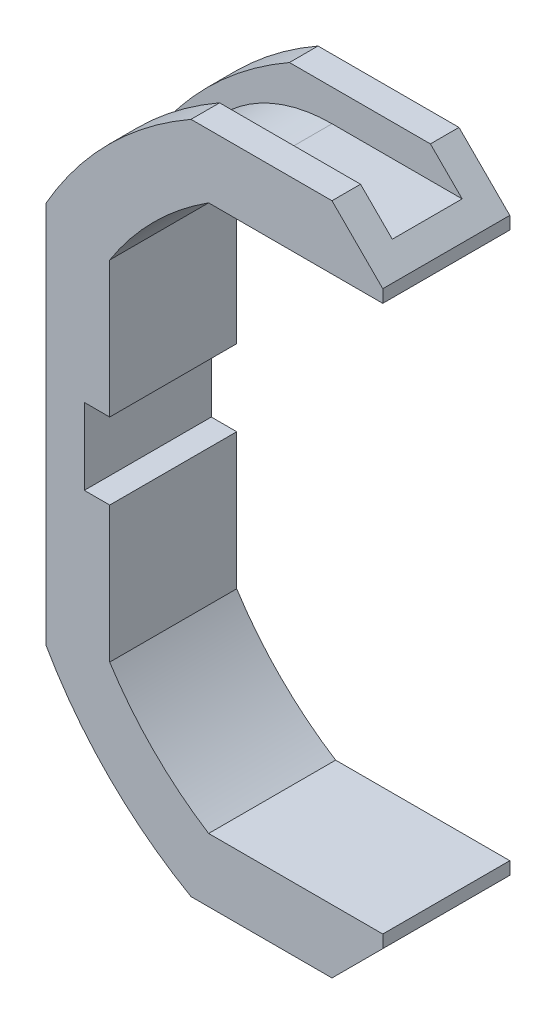
from build123d import *

# Parameters (mm, degrees)
BOSS_EXTRUDE1_DEPTH     = 10
CUT_EXTRUDE1_DEPTH      = 47.99468055
SKETCH8_W               = 5.5
SKETCH8_H               = 5
CUT_EXTRUDE7_DEPTH      = 47.99468055
CUT_EXTRUDE8_DEPTH      = 52.994106262
CUT_EXTRUDE8_DEPTH_BACK = 52.994106262
SKETCH9_W               = 4
SKETCH9_H               = 5.5
FILLET4_R               = 1.5
CUT_EXTRUDE9_DEPTH      = 5.5
CHAMFER1_SIZE           = 4
SKETCH11_W              = 11
SKETCH11_H              = 16.199337742
SKETCH11_W_2            = 4
SKETCH11_H_2            = 6
CUT_EXTRUDE10_DEPTH     = 47.99468055
FILLET5_R               = 12


with BuildPart() as part:
    # Sketch1 → Boss-Extrude1 (new body)
    with BuildSketch(Plane.XY):
        with BuildLine():
            Line((-26.5, -8.099668871), (-26.5, -15.099668871))
            ThreePointArc((-26.5, -15.099668871), (-21.566756826, -21.566756826), (-15.099668871, -26.5))
            Line((-15.099668871, -26.5), (0, -26.5))
            Line((0, -26.5), (0, -21.5))
            Line((0, -21.5), (-13.711309201, -21.5))
            ThreePointArc((-13.711309201, -21.5), (-18.03122292, -18.03122292), (-21.5, -13.711309201))
            Line((-21.5, -13.711309201), (-21.5, 13.711309201))
            ThreePointArc((-21.5, 13.711309201), (-18.03122292, 18.03122292), (-13.711309201, 21.5))
            Line((-13.711309201, 21.5), (0, 21.5))
            Line((0, 21.5), (0, 26.5))
            Line((0, 26.5), (-15.099668871, 26.5))
            ThreePointArc((-15.099668871, 26.5), (-21.566756826, 21.566756826), (-26.5, 15.099668871))
            Line((-26.5, 15.099668871), (-26.5, 8.099668871))
            Line((-26.5, 8.099668871), (-37.5, 8.099668871))
            Line((-37.5, 8.099668871), (-37.5, -8.099668871))
            Line((-37.5, -8.099668871), (-26.5, -8.099668871))
        make_face()
    extrude(amount=BOSS_EXTRUDE1_DEPTH)

    # Sketch2 → Cut-Extrude1 (cut, through all)
    with BuildSketch(Plane.XY.offset(10)):
        with BuildLine():
            Line((-31, 2.907722565), (-31, -2.907722565))
            ThreePointArc((-31, -2.907722565), (-33, -4.907722565), (-35, -2.907722565))
            Line((-35, -2.907722565), (-35, 2.907722565))
            ThreePointArc((-35, 2.907722565), (-33, 4.907722565), (-31, 2.907722565))
        make_face()
    extrude(amount=-CUT_EXTRUDE1_DEPTH, mode=Mode.SUBTRACT)

    # Sketch8 → Cut-Extrude7 (cut, through all)
    with BuildSketch(Plane(origin=(0, 0, 0), x_dir=(0, 0, -1), z_dir=(1, 0, 0))):
        with Locations((-5, 26.5)):
            Rectangle(SKETCH8_W, SKETCH8_H)
        with Locations((-5, -26.5)):
            Rectangle(SKETCH8_W, SKETCH8_H)
    extrude(amount=-CUT_EXTRUDE7_DEPTH, mode=Mode.SUBTRACT)

    # Sketch9 → Cut-Extrude8 (cut, two sides: drawn at the far end of the back side and taken through both)
    with BuildSketch(Plane.XZ.offset(8.099668871).offset(-CUT_EXTRUDE8_DEPTH_BACK)):
        with Locations((-26.5, 5)):
            Rectangle(SKETCH9_W, SKETCH9_H)
    extrude(amount=CUT_EXTRUDE8_DEPTH + CUT_EXTRUDE8_DEPTH_BACK, mode=Mode.SUBTRACT)

    # Fillet4
    fillet4_edges = [part.edges().sort_by_distance(p)[0] for p in [
        (-28.5, 0, 2.25),
        (-28.5, 0, 7.75),
    ]]
    fillet(fillet4_edges, radius=FILLET4_R)

    # Sketch10 → Cut-Extrude9 (cut)
    with BuildSketch(Plane.XY.offset(2.25)):
        with BuildLine():
            Line((-16.314836512, 24), (-18.821530225, 24))
            ThreePointArc((-18.821530225, 24), (-21.856301603, 21.273271498), (-24.5, 18.165902125))
            Line((-24.5, 18.165902125), (-24.5, 15.08975312))
            ThreePointArc((-24.5, 15.08975312), (-20.789536476, 19.895899393), (-16.314836512, 24))
        make_face()
        with BuildLine():
            Line((-24.5, -15.08975312), (-24.5, -18.165902125))
            ThreePointArc((-24.5, -18.165902125), (-21.856301603, -21.273271498), (-18.821530225, -24))
            Line((-18.821530225, -24), (-16.314836512, -24))
            ThreePointArc((-16.314836512, -24), (-20.789536476, -19.895899393), (-24.5, -15.08975312))
        make_face()
    extrude(amount=CUT_EXTRUDE9_DEPTH, mode=Mode.SUBTRACT)

    # Chamfer1
    chamfer1_edges = [part.edges().sort_by_distance(p)[0] for p in [
        (0, -26.5, 8.875),
        (0, 26.5, 8.875),
    ]]
    chamfer(chamfer1_edges, length=CHAMFER1_SIZE)

    # Sketch11 → Cut-Extrude10 (cut, through all)
    with BuildSketch(Plane(origin=(0, 0, 0), x_dir=(-1, 0, 0), z_dir=(0, 0, -1))):
        with Locations((32, 0)):
            Rectangle(SKETCH11_W, SKETCH11_H)
        with Locations((21.5, 0)):
            Rectangle(SKETCH11_W_2, SKETCH11_H_2)
    extrude(amount=-CUT_EXTRUDE10_DEPTH, mode=Mode.SUBTRACT)

    # Fillet5
    fillet5_edges = [part.edges().sort_by_distance(p)[0] for p in [
        (-24.5, 15.08975312, 5),
        (-16.314836512, 24, 5),
        (-16.314836512, -24, 5),
        (-24.5, -15.08975312, 5),
    ]]
    fillet(fillet5_edges, radius=FILLET5_R)


solid = part.part
